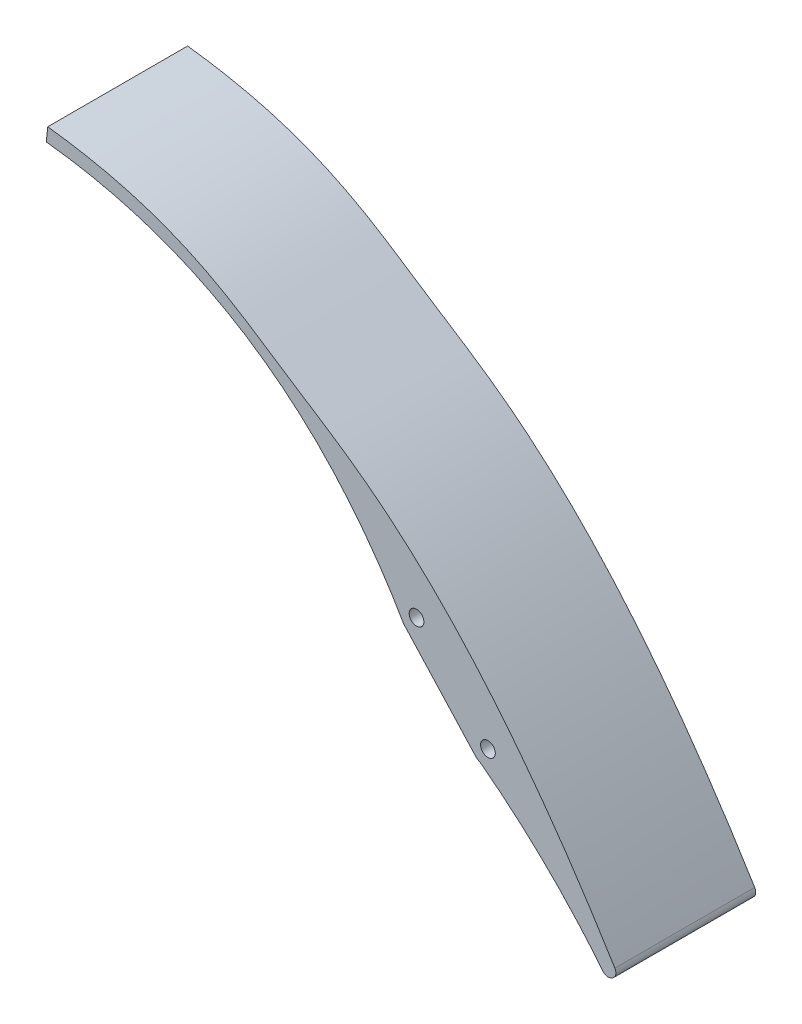
from build123d import *

# Parameters (mm, degrees)
SKETCH1_R           = 1.7
BOSS_EXTRUDE1_DEPTH = 40
FILLET1_R           = 2
SKETCH2_R           = 2.1
CUT_EXTRUDE1_DEPTH  = 5.7


with BuildPart() as part:
    # Sketch1 → Boss-Extrude1 (new body)
    with BuildSketch(Plane.XY):
        with BuildLine():
            Line((106.608651808, -27.499525749), (127.035219834, -49.827804726))
            ThreePointArc((127.035219834, -49.827804726), (127.824871389, -50.526309273), (128.743429567, -51.043715355))
            add(Edge.make_bspline(
                [(128.743429567, -51.043715355), (148.968438393, -66.433726049), (164.6351141, -86.341662758)],
                knots=[0, 0, 0, 1, 1, 1], degree=2))
            Line((164.6351141, -86.341662758), (168.084692517, -84.317331861))
            add(Edge.make_bspline(
                [(4.823156258, 44.740777415), (41.684065008, 40.20447098), (60.016315143, 25.549909268), (92.15426, 5.406490208), (129.856421907, -21.250775717), (168.084692517, -84.317331861)],
                knots=[0, 0, 0, 0, 0.53605532, 0.63605532, 1, 1, 1, 1], degree=3))
            Line((4.823156258, 44.740777415), (4.394431257, 40.763819423))
            add(Edge.make_bspline(
                [(4.394431257, 40.763819423), (71.440728315, 33.332394502), (106.608651808, -27.499525749)],
                knots=[0, 0, 0, 1, 1, 1], degree=2))
        make_face()
        with Locations((130.724364716, -46.452866202)):
            Circle(SKETCH1_R, mode=Mode.SUBTRACT)
        with Locations((110.29779669, -24.124587225)):
            Circle(SKETCH1_R, mode=Mode.SUBTRACT)
    extrude(amount=BOSS_EXTRUDE1_DEPTH)

    # Fillet1
    fillet1_edges = [part.edges().sort_by_distance(p)[0] for p in [
        (164.6351141, -86.341662758, 20),
        (168.084692517, -84.317331861, 20),
    ]]
    fillet(fillet1_edges, radius=FILLET1_R)

    # Sketch2 → Cut-Extrude1 (cut)
    with BuildSketch(Plane.XY.offset(40)):
        with Locations((110.29779669, -24.124587225)):
            Circle(SKETCH2_R)
        with Locations((130.724364716, -46.452866202)):
            Circle(SKETCH2_R)
    cut_extrude1 = extrude(amount=-CUT_EXTRUDE1_DEPTH, mode=Mode.SUBTRACT)

    # Mirror1: Cut-Extrude1 across plane
    add(cut_extrude1.mirror(Plane.XY.offset(20)), mode=Mode.SUBTRACT)


solid = part.part
